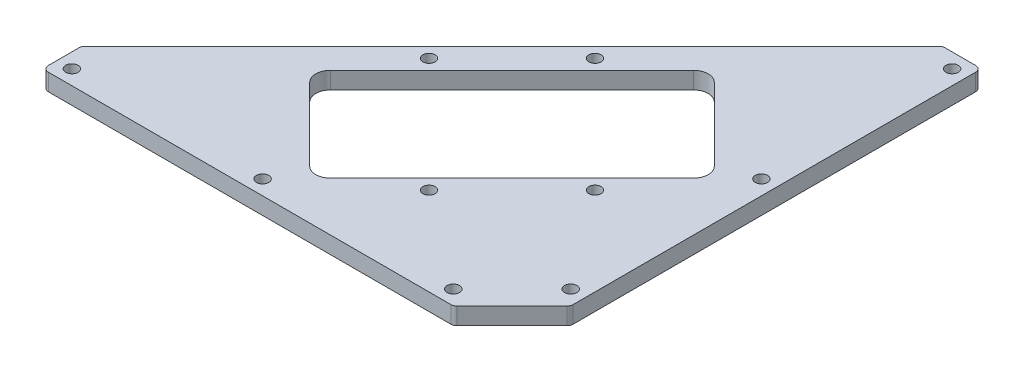
from build123d import *

# Parameters (mm, degrees)
SKETCH_1_R      = 2.1
EXTRUDE_1_DEPTH = 5.8
FILLET_1_R      = 2
FILLET_2_R      = 5


with BuildPart() as part:
    # ｽｹｯﾁ1 → ﾎﾞｽ - 押し出し1 (new body)
    with BuildSketch(Plane(origin=(0, 0, 0), x_dir=(1, 0, 0), z_dir=(0, 1, 0))):
        Polygon((0, 20), (0, 160), (-10, 160), (-13.241161391, 160), (-45.078057301, 128.16310409), (-128.16310409, 45.078057301), (-160, 13.241161391), (-160, 10), (-160, 0), (-20, 0), align=None)
        with Locations(Location((-5, 25, 0), (0, 0, 270))):
            Circle(SKETCH_1_R, mode=Mode.SUBTRACT)
        with Locations(Location((-5, 90, 0), (0, 0, 270))):
            Circle(SKETCH_1_R, mode=Mode.SUBTRACT)
        with Locations(Location((-90, 5, 0), (0, 0, 270))):
            Circle(SKETCH_1_R, mode=Mode.SUBTRACT)
        with Locations(Location((-25, 5, 0), (0, 0, 270))):
            Circle(SKETCH_1_R, mode=Mode.SUBTRACT)
        with Locations(Location((-68.942911166, 97.227182413, 0), (0, 0, 270))):
            Circle(SKETCH_1_R, mode=Mode.SUBTRACT)
        with Locations(Location((-30.0520382, 58.336309448, 0), (0, 0, 270))):
            Circle(SKETCH_1_R, mode=Mode.SUBTRACT)
        with Locations(Location((-58.336309448, 30.0520382, 0), (0, 0, 270))):
            Circle(SKETCH_1_R, mode=Mode.SUBTRACT)
        with Locations(Location((-97.227182413, 68.942911166, 0), (0, 0, 270))):
            Circle(SKETCH_1_R, mode=Mode.SUBTRACT)
        with Locations(Location((-5, 155, 0), (0, 0, 270))):
            Circle(SKETCH_1_R, mode=Mode.SUBTRACT)
        with Locations(Location((-155, 5, 0), (0, 0, 270))):
            Circle(SKETCH_1_R, mode=Mode.SUBTRACT)
        Polygon((-82.201163313, 13.258252147), (-13.258252147, 82.201163313), (-45.078057301, 114.020968466), (-114.020968466, 45.078057301), align=None, mode=Mode.SUBTRACT)
    extrude(amount=EXTRUDE_1_DEPTH)

    # ﾌｨﾚｯﾄ1
    fillet_1_edges = [part.edges().sort_by_distance(p)[0] for p in [
        (-13.241161391, 2.9, -160),
        (0, 2.9, -160),
        (0, 2.9, -20),
        (-20, 2.9, 0),
        (-160, 2.9, 0),
        (-160, 2.9, -13.241161391),
    ]]
    fillet(fillet_1_edges, radius=FILLET_1_R)

    # ﾌｨﾚｯﾄ2
    fillet_2_edges = [part.edges().sort_by_distance(p)[0] for p in [
        (-82.201163313, 2.9, -13.258252147),
        (-13.258252147, 2.9, -82.201163313),
        (-45.078057301, 2.9, -114.020968466),
        (-114.020968466, 2.9, -45.078057301),
    ]]
    fillet(fillet_2_edges, radius=FILLET_2_R)


solid = part.part
